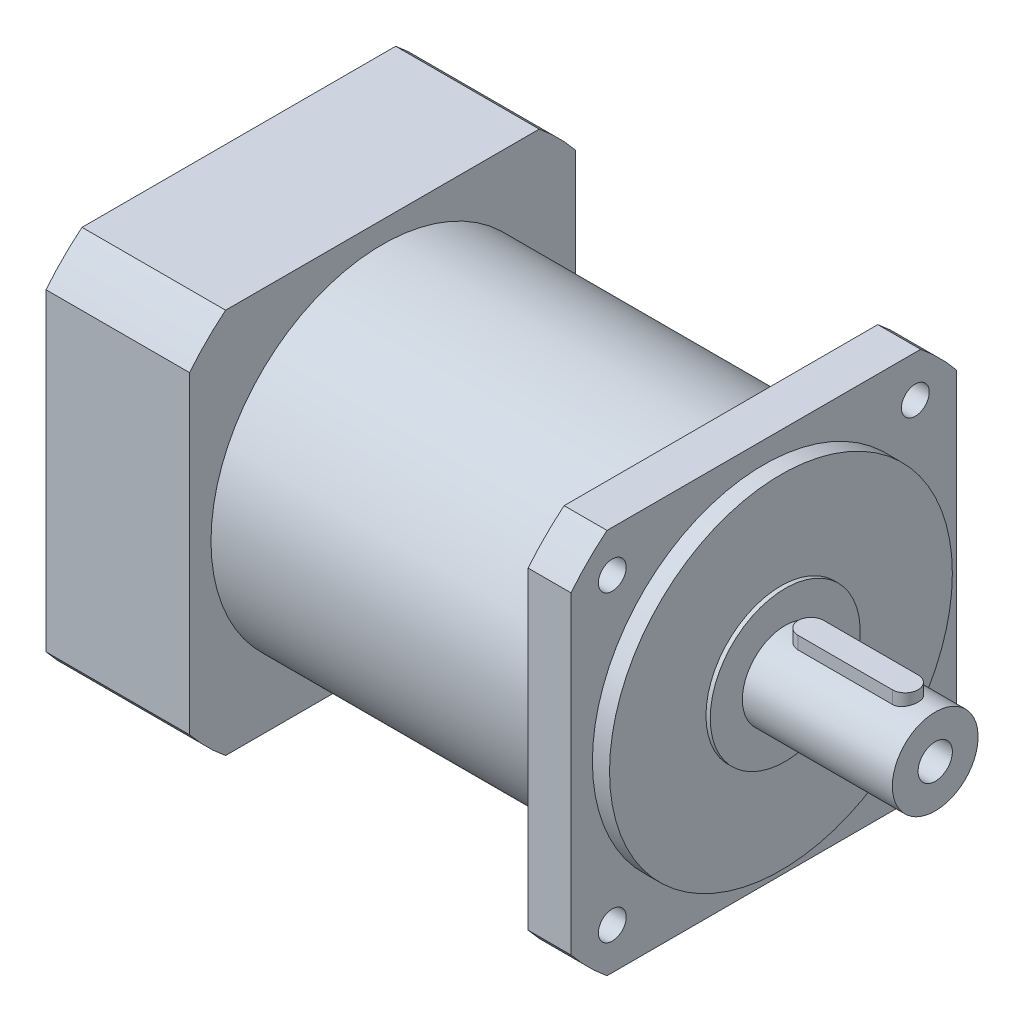
from build123d import *

# Parameters (mm, degrees)
EXTRUDE_1_DEPTH     = 12.5
CUT_EXTRUDE_1_REACH = 71.282
SKETCH_3_R          = 4
SKETCH_4_R          = 3.25
EXTRUDE_2_DEPTH     = 10
SKETCH_5_R          = 40
EXTRUDE_3_DEPTH     = 79
EXTRUDE_4_DEPTH     = 33.5
CUT_EXTRUDE_START   = -3.5
SKETCH_7_R          = 40
CUT_EXTRUDE_2_DEPTH = 3.5
SKETCH_8_R          = 7
CUT_EXTRUDE_3_DEPTH = 30
SKETCH_9_R          = 3
CUT_EXTRUDE_4_DEPTH = 15


with BuildPart() as part:
    # 草图1 → 旋转1 (revolve)
    with BuildSketch(Plane.XY, mode=Mode.PRIVATE) as revolve_1_sk:
        Polygon((0, 0), (0, 40), (4, 40), (4, 17.5), (5, 17.5), (5, 10), (40, 10), (40, 0), align=None)
    revolve(revolve_1_sk.sketch.rotate(Axis((-53.526377828, 0, 0), (1, 0, 0)), 90), axis=Axis((-53.526377828, 0, 0), (1, 0, 0)))

    # 草图2 → 凸台-拉伸1 (add)
    with BuildSketch(Plane(origin=(0, 0, 0), x_dir=(1, 0, 0), z_dir=(0, 1, 0))):
        with BuildLine():
            Line((11, 3), (33, 3))
            ThreePointArc((33, 3), (36, 0), (33, -3))
            Line((33, -3), (11, -3))
            ThreePointArc((11, -3), (8, 0), (11, 3))
        make_face()
    extrude(amount=EXTRUDE_1_DEPTH)

    # 草图3 → 切除-拉伸1 (cut, up to next)
    with BuildSketch(Plane(origin=(40, 0, 0), x_dir=(0, 0, -1), z_dir=(1, 0, 0)), mode=Mode.PRIVATE) as cut_extrude_1_sk1:
        Circle(SKETCH_3_R)
    cut_extrude_1_tool1 = extrude(cut_extrude_1_sk1.sketch, amount=-CUT_EXTRUDE_1_REACH, mode=Mode.PRIVATE) & part.part
    add(cut_extrude_1_tool1.solids().sort_by_distance((40, 0, 0))[0], mode=Mode.SUBTRACT)

    # 草图4 → 凸台-拉伸2 (add)
    with BuildSketch(Plane.ZY):
        with BuildLine():
            Line((36.592348927, -45), (-36.592348927, -45))
            ThreePointArc((-36.592348927, -45), (-41.012193309, -41.012193309), (-45, -36.592348927))
            Line((-45, -36.592348927), (-45, 36.592348927))
            ThreePointArc((-45, 36.592348927), (-41.012193309, 41.012193309), (-36.592348927, 45))
            Line((-36.592348927, 45), (36.592348927, 45))
            ThreePointArc((36.592348927, 45), (41.012193309, 41.012193309), (45, 36.592348927))
            Line((45, 36.592348927), (45, -36.592348927))
            ThreePointArc((45, -36.592348927), (41.012193309, -41.012193309), (36.592348927, -45))
        make_face()
        with Locations((-35.355339059, 35.355339059)):
            Circle(SKETCH_4_R, mode=Mode.SUBTRACT)
        with Locations(Location((35.355339059, -35.355339059, 0), (0, 0, 180))):
            Circle(SKETCH_4_R, mode=Mode.SUBTRACT)
        with Locations((35.355339059, 35.355339059)):
            Circle(SKETCH_4_R, mode=Mode.SUBTRACT)
        with Locations(Location((-35.355339059, -35.355339059, 0), (0, 0, 180))):
            Circle(SKETCH_4_R, mode=Mode.SUBTRACT)
    extrude(amount=EXTRUDE_2_DEPTH)

    # 草图5 → 凸台-拉伸3 (add)
    with BuildSketch(Plane.ZY.offset(10)):
        Circle(SKETCH_5_R)
    extrude(amount=EXTRUDE_3_DEPTH)

    # 草图6 → 凸台-拉伸4 (add)
    with BuildSketch(Plane.ZY.offset(89)):
        with BuildLine():
            Line((36.592348927, 45), (-36.592348927, 45))
            ThreePointArc((-36.592348927, 45), (-41.012193309, 41.012193309), (-45, 36.592348927))
            Line((-45, 36.592348927), (-45, -36.592348927))
            ThreePointArc((-45, -36.592348927), (-41.012193309, -41.012193309), (-36.592348927, -45))
            Line((-36.592348927, -45), (36.592348927, -45))
            ThreePointArc((36.592348927, -45), (41.012193309, -41.012193309), (45, -36.592348927))
            Line((45, -36.592348927), (45, 36.592348927))
            ThreePointArc((45, 36.592348927), (41.012193309, 41.012193309), (36.592348927, 45))
        make_face()
    extrude(amount=EXTRUDE_4_DEPTH)

    # 草图7 → 切除-拉伸2 (cut)
    with BuildSketch(Plane.ZY.offset(122.5).offset(CUT_EXTRUDE_START)):
        Circle(SKETCH_7_R)
    extrude(amount=CUT_EXTRUDE_2_DEPTH, mode=Mode.SUBTRACT)

    # 草图8 → 切除-拉伸3 (cut)
    with BuildSketch(Plane.ZY.offset(122.5)):
        Circle(SKETCH_8_R)
    extrude(amount=-CUT_EXTRUDE_3_DEPTH, mode=Mode.SUBTRACT)

    # 草图9 → 切除-拉伸4 (cut)
    with BuildSketch(Plane.ZY.offset(122.5)):
        with Locations((35.355339059, 35.355339059)):
            Circle(SKETCH_9_R)
        with Locations(Location((-35.355339059, 35.355339059, 0), (0, 0, 180))):
            Circle(SKETCH_9_R)
        with Locations(Location((35.355339059, -35.355339059, 0), (0, 0, 180))):
            Circle(SKETCH_9_R)
        with Locations((-35.355339059, -35.355339059)):
            Circle(SKETCH_9_R)
    extrude(amount=-CUT_EXTRUDE_4_DEPTH, mode=Mode.SUBTRACT)


solid = part.part
